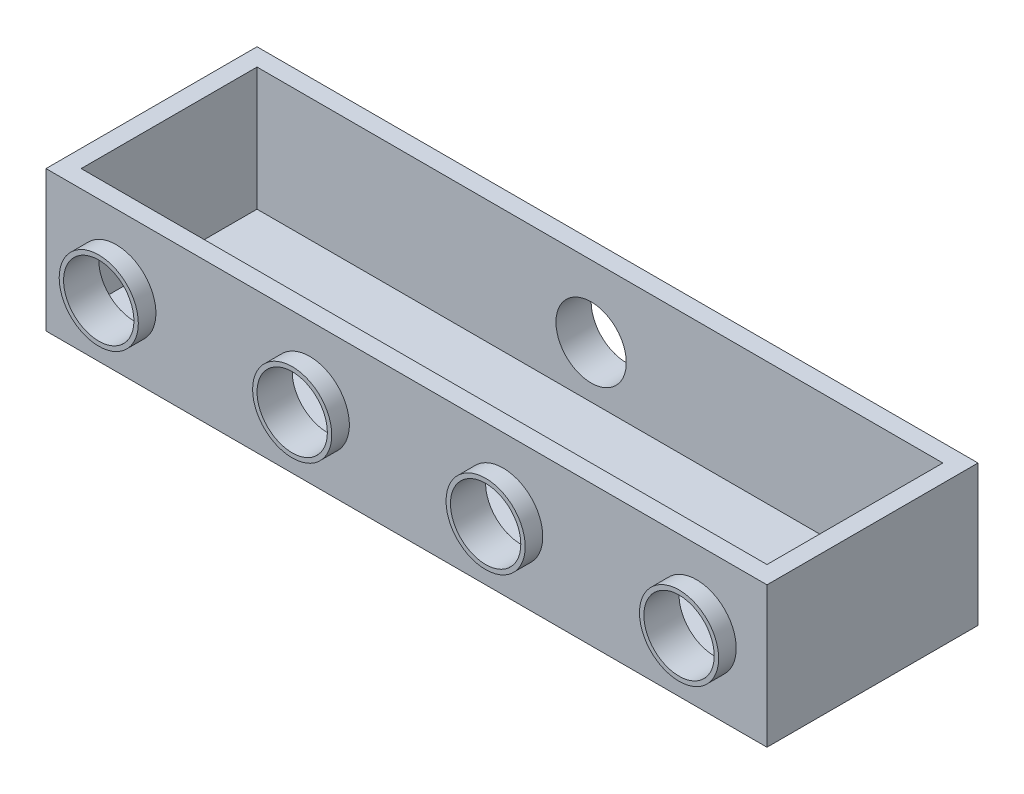
from build123d import *

# Parameters (mm, degrees)
SKETCH1_W           = 1041.4
SKETCH1_H           = 304.8
BOSS_EXTRUDE1_DEPTH = 203.2
SKETCH3_R           = 57.15
BOSS_EXTRUDE2_DEPTH = 25.4
SKETCH4_R           = 57.15
BOSS_EXTRUDE3_DEPTH = 25.4
SKETCH5_W           = 990.6
SKETCH5_H           = 254
CUT_EXTRUDE1_DEPTH  = 177.8
SKETCH6_R           = 50.8
CUT_EXTRUDE2_DEPTH  = 177.8
SKETCH7_R           = 50.8
CUT_EXTRUDE3_DEPTH  = 177.8


with BuildPart() as part:
    # Sketch1 → Boss-Extrude1 (new body)
    with BuildSketch(Plane(origin=(0, 0, 0), x_dir=(1, 0, 0), z_dir=(0, 1, 0))):
        with Locations((520.7, 152.4)):
            Rectangle(SKETCH1_W, SKETCH1_H)
    extrude(amount=BOSS_EXTRUDE1_DEPTH)

    # Sketch3 → Boss-Extrude2 (add)
    with BuildSketch(Plane.XY):
        with Locations(Location((101.6, 101.6, 0), (0, 0, 180))):
            Circle(SKETCH3_R)
        with Locations(Location((381, 101.6, 0), (0, 0, 180))):
            Circle(SKETCH3_R)
        with Locations(Location((660.4, 101.6, 0), (0, 0, 180))):
            Circle(SKETCH3_R)
        with Locations(Location((939.8, 101.6, 0), (0, 0, 180))):
            Circle(SKETCH3_R)
    extrude(amount=BOSS_EXTRUDE2_DEPTH)

    # Sketch4 → Boss-Extrude3 (add)
    with BuildSketch(Plane(origin=(0, 0, -304.8), x_dir=(-1, 0, 0), z_dir=(0, 0, -1))):
        with Locations(Location((-508, 100.070914483, 0), (0, 0, 180))):
            Circle(SKETCH4_R)
    extrude(amount=BOSS_EXTRUDE3_DEPTH)

    # Sketch5 → Cut-Extrude1 (cut)
    with BuildSketch(Plane(origin=(0, 203.2, 0), x_dir=(1, 0, 0), z_dir=(0, 1, 0))):
        with Locations((520.7, 152.4)):
            Rectangle(SKETCH5_W, SKETCH5_H)
    extrude(amount=-CUT_EXTRUDE1_DEPTH, mode=Mode.SUBTRACT)

    # Sketch6 → Cut-Extrude2 (cut)
    with BuildSketch(Plane.XY.offset(25.4)):
        with Locations((101.6, 101.6)):
            Circle(SKETCH6_R)
        with Locations((381, 101.6)):
            Circle(SKETCH6_R)
        with Locations((660.4, 101.6)):
            Circle(SKETCH6_R)
        with Locations((939.8, 101.6)):
            Circle(SKETCH6_R)
    extrude(amount=-CUT_EXTRUDE2_DEPTH, mode=Mode.SUBTRACT)

    # Sketch7 → Cut-Extrude3 (cut)
    with BuildSketch(Plane(origin=(0, 0, -330.2), x_dir=(-1, 0, 0), z_dir=(0, 0, -1))):
        with Locations((-508, 100.070914483)):
            Circle(SKETCH7_R)
    extrude(amount=-CUT_EXTRUDE3_DEPTH, mode=Mode.SUBTRACT)


solid = part.part
